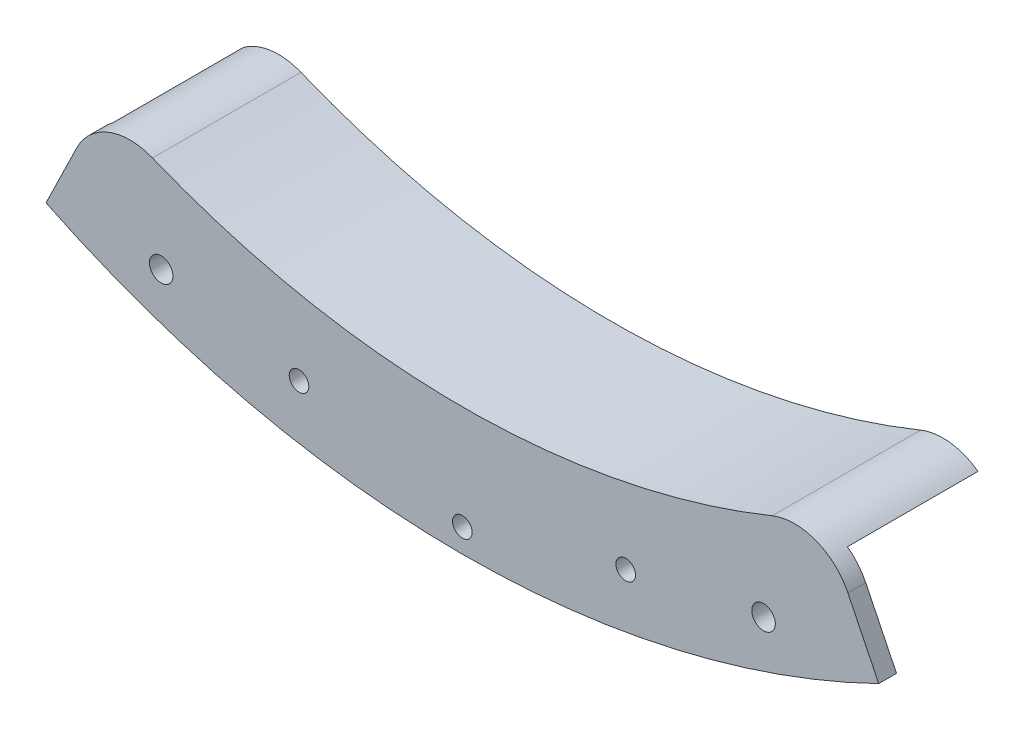
from build123d import *
from build123d.topology import SkipClean

# Parameters (mm, degrees)
EXTRUDE_1_DEPTH     = 25
EXTRUDE_START       = -3
EXTRUDE_2_DEPTH     = 3
EXTRUDE_START_2     = 22
SKETCH_3_R          = 1.649999999999988
SKETCH_3_R_2        = 1.6500000000000072
EXTRUDE_3_DEPTH     = 22
SKETCH_4_R          = 1.6499999999999844
SKETCH_4_R_2        = 1.6500000000000101
SKETCH_4_R_3        = 1.6499999999999744
CUT_EXTRUDE_1_DEPTH = 177.47813778434883
FILLET_1_R          = 10
SKETCH_7_R          = 1.9845527955415248
CUT_EXTRUDE_2_DEPTH = 177.0782017054684


with BuildPart() as part:
    # 草图1 → 凸台-拉伸1 (new body)
    with BuildSketch(Plane.XY):
        with BuildLine():
            ThreePointArc((-6.39904e-12, -143.5), (32.28047629834163, -139.82210429668194), (62.90625956423284, -128.97694564393035))
            Line((62.90625956423282, -128.97694564393035), (60.71440383028742, -124.48297541243448))
            ThreePointArc((60.71440383028932, -124.4829754124336), (31.15572102662481, -134.95025397275518), (-3.22377e-12, -138.5))
            Line((0, -138.49999999999997), (0, -143.49999999999997))
        make_face()
        with BuildLine():
            Line((-60.71440383028735, -124.48297541243457), (-62.906259564232734, -128.97694564393038))
            ThreePointArc((-62.906259564232776, -128.97694564393038), (-32.28047629834789, -139.8221042966805), (-6.39904e-12, -143.5))
            Line((0, -143.49999999999997), (0, -138.49999999999997))
            ThreePointArc((-3.22377e-12, -138.5), (-31.155721026627976, -134.95025397275447), (-60.71440383028926, -124.48297541243363))
        make_face()
    extrude(amount=EXTRUDE_1_DEPTH)

    # 草图2 → 凸台-拉伸2 (add)
    with BuildSketch(Plane.XY.offset(25).offset(EXTRUDE_START)):
        with BuildLine():
            Line((70.13938348625264, -143.8070474078666), (62.906259564232826, -128.97694564393032))
            ThreePointArc((62.90625956423283, -128.97694564393032), (4.796e-14, -143.5), (-62.90625956423274, -128.97694564393038))
            Line((-62.90625956423273, -128.97694564393043), (-70.13938348625253, -143.8070474078667))
            ThreePointArc((-70.13938348625257, -143.80704740786663), (-2.939e-14, -160), (70.13938348625264, -143.8070474078666))
        make_face()
    extrude(amount=EXTRUDE_2_DEPTH)

    # 草图3 → 凸台-拉伸3 (add)
    with SkipClean():  # the faces are left unmerged after this step: merging them gives an invalid solid
        with BuildSketch(Plane(origin=(0, 0, 22.000000000000004), x_dir=(-1, 0, 0), z_dir=(0, 0, -1)).offset(EXTRUDE_START_2)):
            with Locations(Location((-27.51756434931431, -148.4714910421571, 0), (0, 0, 180))):
                Circle(SKETCH_3_R)
            with Locations(Location((1.91e-14, -156, 0), (0, 0, 180))):
                Circle(SKETCH_3_R_2)
            with BuildLine():
                Line((-16.16900754927144, -159.18091341260617), (-14.501578645752826, -142.76538171693122))
                ThreePointArc((-14.501578645754455, -142.76538171693085), (-17.239636372772704, -142.46067856687523), (-19.971339987769433, -142.10346786441525))
                Line((-19.971339987769415, -142.10346786441528), (-22.267696153610498, -158.4428909986512))
                ThreePointArc((-22.26769615360823, -158.44289099865154), (-19.221894213540633, -158.84117470871163), (-16.169007549267842, -159.1809134126065))
            make_face()
            with BuildLine():
                ThreePointArc((19.9713399877666, -142.10346786441565), (17.239636372771262, -142.4606785668754), (14.501578645754403, -142.76538171693088))
                Line((14.50157864575282, -142.76538171693116), (16.16900754927144, -159.18091341260617))
                ThreePointArc((16.16900754926785, -159.1809134126065), (19.22189421354061, -158.84117470871166), (22.26769615360823, -158.44289099865156))
                Line((22.267696153610498, -158.4428909986512), (19.971339987769422, -142.10346786441534))
            make_face()
            with Locations((27.51756434931431, -148.4714910421571)):
                Circle(SKETCH_3_R)
        extrude(amount=-EXTRUDE_3_DEPTH)

    # 草图4 → 切除-拉伸1 (cut, through all)
    with SkipClean():  # the faces are left unmerged after this step: merging them gives an invalid solid
        with BuildSketch(Plane(origin=(0, 0, 0), x_dir=(-1, 0, 0), z_dir=(0, 0, -1))):
            with Locations((-27.51756434931431, -148.4714910421571)):
                Circle(SKETCH_4_R)
            with Locations((1.91e-14, -156)):
                Circle(SKETCH_4_R_2)
            with Locations((27.51756434931431, -148.4714910421571)):
                Circle(SKETCH_4_R_3)
        extrude(amount=-CUT_EXTRUDE_1_DEPTH, mode=Mode.SUBTRACT)

    # 草图6 → 切除-旋转1 (revolve, cut)
    with BuildSketch(Plane(origin=(0, 0, 0), x_dir=(0, 0, -1), z_dir=(0.9902680687415703, 0.13917310096006566, 0))):
        Polygon((6.94e-15, -143.5), (-22.000000000000007, -160), (6.94e-15, -160), align=None)
    revolve(axis=Axis((0, 0, 25), (0, 0, -1)), mode=Mode.SUBTRACT)

    # 圆角1
    fillet_1_edges = [part.edges().sort_by_distance(p)[0] for p in [
        (60.71440383028837, -124.48297541243404, 12.5),
        (-60.714403830288305, -124.48297541243412, 12.5),
    ]]
    fillet(fillet_1_edges, radius=FILLET_1_R)

    # 草图7 → 切除-拉伸2 (cut, through all)
    with BuildSketch(Plane(origin=(0, 0, 22.000000000000004), x_dir=(-1, 0, 0), z_dir=(0, 0, -1))):
        with Locations((50.73693085640144, -143.81242591401045)):
            Circle(SKETCH_7_R)
        with Locations(Location((-50.7369308564015, -143.81242591401042, 0), (0, 0, 180))):
            Circle(SKETCH_7_R)
    extrude(amount=-CUT_EXTRUDE_2_DEPTH, mode=Mode.SUBTRACT)


solid = part.part
